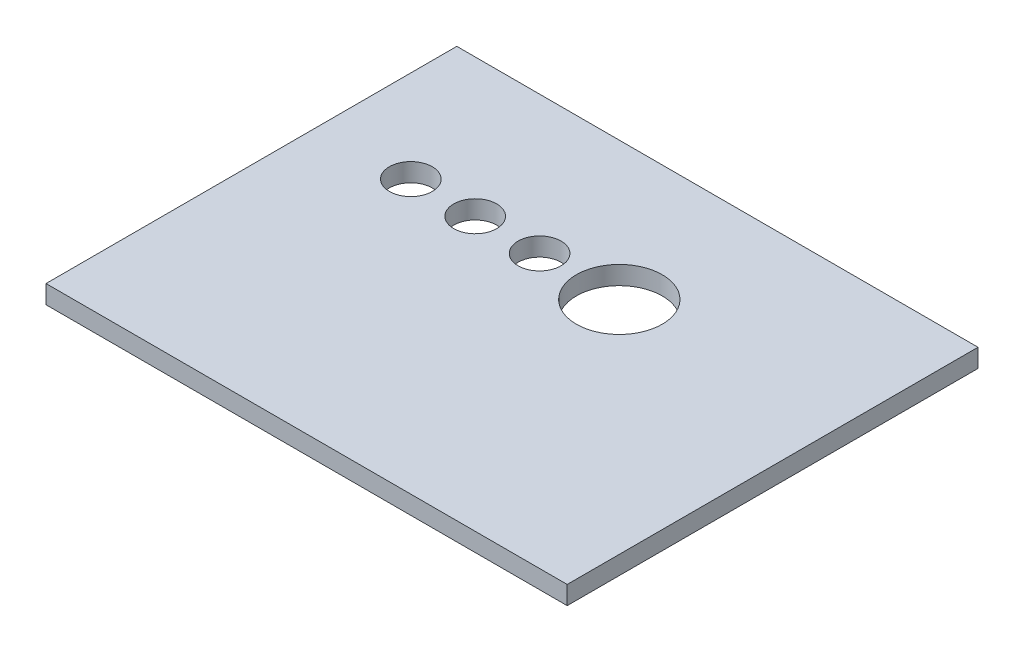
from build123d import *

# Parameters (mm, degrees)
SKETCH1_W           = 85
SKETCH1_H           = 67
SKETCH1_R           = 3.5
SKETCH1_R_2         = 7
BOSS_EXTRUDE1_DEPTH = 3


with BuildPart() as part:
    # Sketch1 → Boss-Extrude1 (new body)
    with BuildSketch(Plane(origin=(0, 0, 0), x_dir=(1, 0, 0), z_dir=(0, 1, 0))):
        Rectangle(SKETCH1_W, SKETCH1_H)
        with Locations(Location((-27.5, 11, 0), (0, 0, 270))):
            Circle(SKETCH1_R, mode=Mode.SUBTRACT)
        with Locations(Location((-17, 11, 0), (0, 0, 270))):
            Circle(SKETCH1_R, mode=Mode.SUBTRACT)
        with Locations(Location((-6.5, 11, 0), (0, 0, 270))):
            Circle(SKETCH1_R, mode=Mode.SUBTRACT)
        with Locations(Location((6.5, 11, 0), (0, 0, 270))):
            Circle(SKETCH1_R_2, mode=Mode.SUBTRACT)
    extrude(amount=BOSS_EXTRUDE1_DEPTH)


solid = part.part
